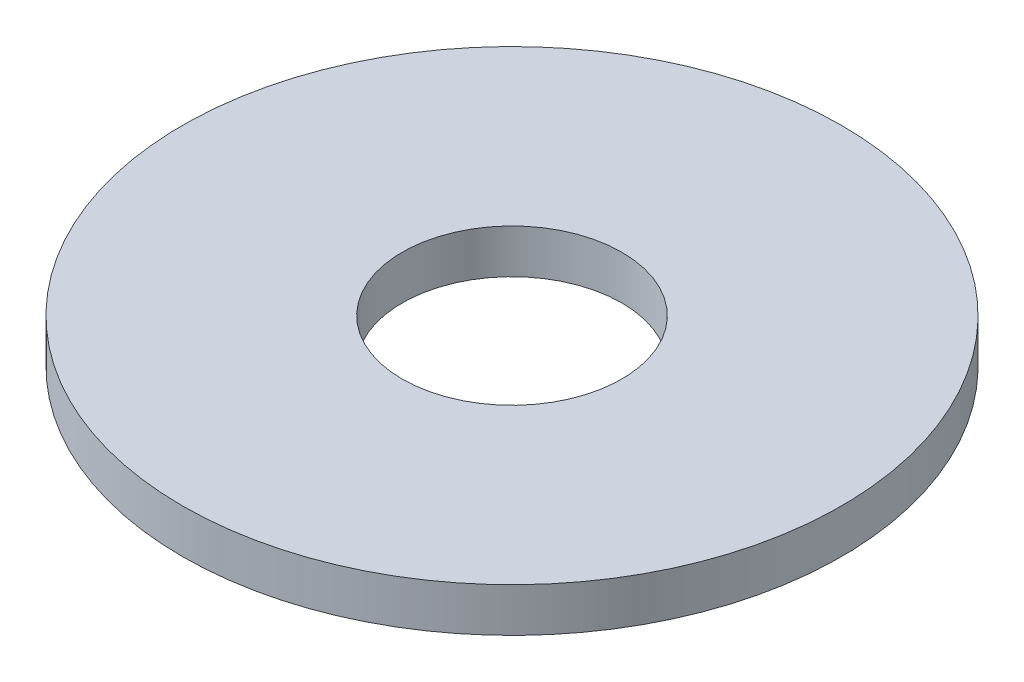
from build123d import *

# Parameters (mm, degrees)
SKETCH1_R           = 15
SKETCH1_R_2         = 5
BOSS_EXTRUDE1_DEPTH = 1


with BuildPart() as part:
    # Sketch1 → Boss-Extrude1 (new, symmetric)
    with BuildSketch(Plane(origin=(0, 0, 0), x_dir=(1, 0, 0), z_dir=(0, 1, 0))):
        with Locations(Location((0, 0, 0), (0, 0, 270))):
            Circle(SKETCH1_R)
        with Locations(Location((0, 0, 0), (0, 0, 270))):
            Circle(SKETCH1_R_2, mode=Mode.SUBTRACT)
    extrude(amount=BOSS_EXTRUDE1_DEPTH, both=True)


solid = part.part
